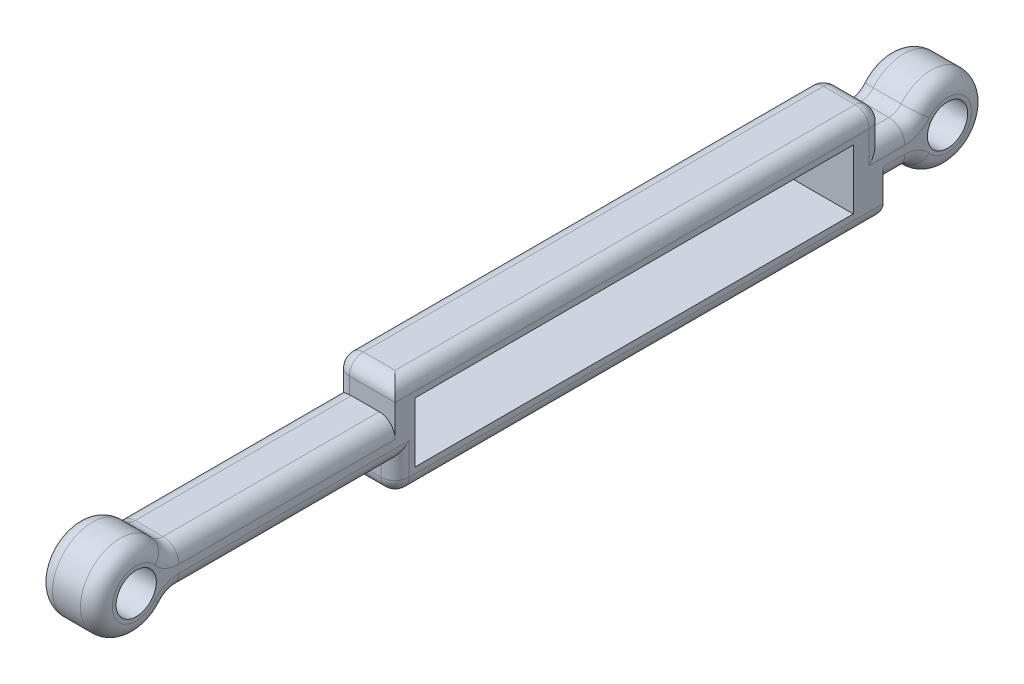
from build123d import *

# Parameters (mm, degrees)
SKETCH1_W           = 220
SKETCH1_H           = 30
BOSS_EXTRUDE1_DEPTH = 30
SKETCH2_R           = 10.1
CUT_EXTRUDE1_DEPTH  = 30
SKETCH3_R           = 10.1
CUT_EXTRUDE2_DEPTH  = 30
FILLET1_R           = 8
FILLET2_R           = 8
FILLET4_R           = 7
SCALE1_SCALE        = 0.5


with BuildPart() as part:
    # Sketch1 → Boss-Extrude1 (new body)
    with BuildSketch(Plane(origin=(0, 0, 0), x_dir=(0, 0, -1), z_dir=(1, 0, 0))):
        with BuildLine():
            Line((-122.679491924, 10), (-10, 10))
            Line((-10, 10), (-10, 25))
            Line((-10, 25), (235, 25))
            Line((235, 25), (235, 10))
            Line((235, 10), (250, 10))
            ThreePointArc((250, 10), (287.320508076, 0), (250, -10))
            Line((250, -10), (235, -10))
            Line((235, -10), (235, -25))
            Line((235, -25), (-10, -25))
            Line((-10, -25), (-10, -10))
            Line((-10, -10), (-122.679491924, -10))
            ThreePointArc((-122.679491924, -10), (-160, 0), (-122.679491924, 10))
        make_face()
        with Locations((110, 0)):
            Rectangle(SKETCH1_W, SKETCH1_H, mode=Mode.SUBTRACT)
    extrude(amount=BOSS_EXTRUDE1_DEPTH)

    # Sketch2 → Cut-Extrude1 (cut)
    with BuildSketch(Plane(origin=(0, 0, 0), x_dir=(0, 0, -1), z_dir=(1, 0, 0))):
        with Locations((-140, 0)):
            Circle(SKETCH2_R)
    extrude(amount=CUT_EXTRUDE1_DEPTH, mode=Mode.SUBTRACT)

    # Sketch3 → Cut-Extrude2 (cut)
    with BuildSketch(Plane.ZY):
        with Locations((-267.320508076, 0)):
            Circle(SKETCH3_R)
    extrude(amount=-CUT_EXTRUDE2_DEPTH, mode=Mode.SUBTRACT)

    # Fillet1
    fillet1_edges = [part.edges().sort_by_distance(p)[0] for p in [
        (0, -10, 66.339745962),
        (0, 0, 160),
        (0, 10, 66.339745962),
        (30, 10, 66.339745962),
        (30, 0, 160),
        (15, -10, 122.679491924),
        (15, 10, 122.679491924),
        (30, -10, 66.339745962),
    ]]
    fillet(fillet1_edges, radius=FILLET1_R)

    # Fillet2
    fillet2_edges = [part.edges().sort_by_distance(p)[0] for p in [
        (0, 10, -242.5),
        (0, 0, -287.320508076),
        (0, -10, -242.5),
        (15, 10, -250),
        (15, -10, -250),
        (30, -10, -242.5),
        (30, 0, -287.320508076),
        (30, 10, -242.5),
    ]]
    fillet(fillet2_edges, radius=FILLET2_R)

    # Fillet4
    fillet4_edges = [part.edges().sort_by_distance(p)[0] for p in [
        (15, -25, 10),
        (30, -25, -112.5),
        (15, -25, -235),
        (0, -25, -112.5),
        (15, 25, -235),
        (30, 25, -112.5),
        (15, 25, 10),
        (0, 25, -112.5),
        (30, 13.5, -235),
        (0, 13.5, -235),
        (0, 13.5, 10),
        (30, -13.5, 10),
    ]]
    fillet(fillet4_edges, radius=FILLET4_R)


with BuildPart() as part_1:
    # Scale1: scaled about (0, 0, 0)
    add(part.part.scale(SCALE1_SCALE))


solid = part_1.part
